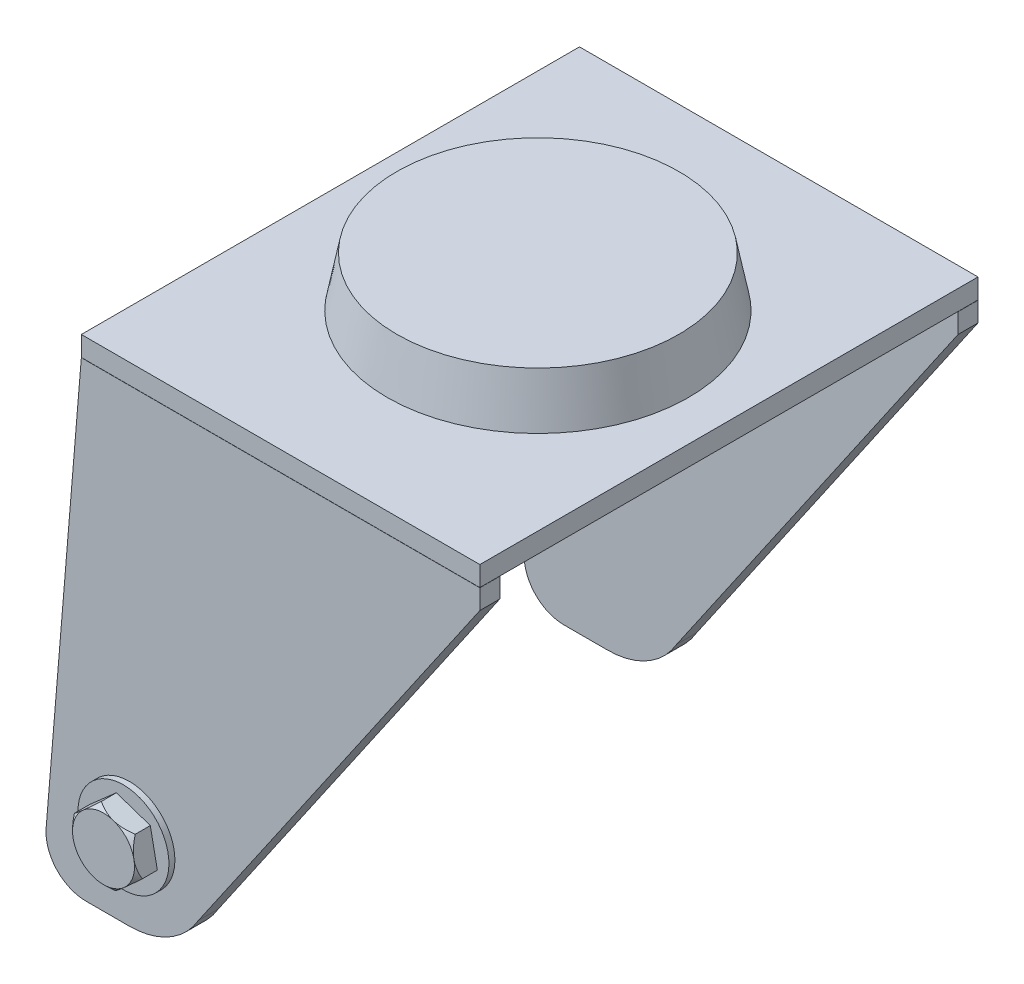
from build123d import *

# Parameters (mm, degrees)
BOSS_EXTRUDE1_DEPTH = 10
BOSS_EXTRUDE2_DEPTH = 10
SKETCH3_W           = 200
SKETCH3_H           = 250
BOSS_EXTRUDE3_DEPTH = 10
SKETCH4_R           = 75.651744531
BOSS_EXTRUDE4_DEPTH = 25
BOSS_EXTRUDE4_TAPER = 11
SKETCH5_R           = 22.82126393
BOSS_EXTRUDE5_DEPTH = 3
BOSS_EXTRUDE6_DEPTH = 10
SKETCH7_R           = 20.621564537
SKETCH7_R_2         = 15.559996937
CUT_EXTRUDE2_DEPTH  = 10
CUT_EXTRUDE2_TAPER  = 45
SKETCH9_W           = 242.267839315
SKETCH9_H           = 0.1
CUT_EXTRUDE3_DEPTH  = 408
SKETCH10_W          = 1.794871794
SKETCH10_H          = 10
SKETCH10_W_2        = 3.461538462
SKETCH10_H_2        = 1.666666666
CUT_EXTRUDE4_DEPTH  = 0.1


with BuildPart() as part:
    # Sketch1 → Boss-Extrude1 (new body)
    with BuildSketch(Plane.XY):
        with BuildLine():
            Line((-24.126688584, 195), (-41.81071568, -18.490608798))
            ThreePointArc((-41.81071568, -18.490608798), (-36.593256778, -33.687458068), (-21.878977353, -40.141610697))
            Line((-21.878977353, -40.141610697), (0, -40.141610697))
            ThreePointArc((0, -40.141610697), (19.914701785, -34.853314938), (34.582238289, -20.381798357))
            Line((34.582238289, -20.381798357), (175.873311416, 185))
            Line((175.873311416, 185), (175.873311416, 195))
            Line((175.873311416, 195), (-24.126688584, 195))
        make_face()
    extrude(amount=BOSS_EXTRUDE1_DEPTH)


with BuildPart() as body_2:
    # Sketch2 → Boss-Extrude2 (new body)
    with BuildSketch(Plane(origin=(0, 0, -230), x_dir=(-1, 0, 0), z_dir=(0, 0, -1))):
        with BuildLine():
            Line((41.81071568, -18.490608798), (24.126688584, 195))
            Line((24.126688584, 195), (-175.873311416, 195))
            Line((-175.873311416, 195), (-175.873311416, 185))
            Line((-175.873311416, 185), (-34.582238289, -20.381798357))
            ThreePointArc((-34.582238289, -20.381798357), (-19.914701785, -34.853314938), (0, -40.141610697))
            Line((0, -40.141610697), (21.878977353, -40.141610697))
            ThreePointArc((21.878977353, -40.141610697), (36.593256778, -33.687458068), (41.81071568, -18.490608798))
        make_face()
    extrude(amount=BOSS_EXTRUDE2_DEPTH)


with BuildPart() as body_3:
    # Sketch3 → Boss-Extrude3 (new body)
    with BuildSketch(Plane(origin=(0, 195, 0), x_dir=(1, 0, 0), z_dir=(0, 1, 0))):
        with Locations((75.873311416, 115)):
            Rectangle(SKETCH3_W, SKETCH3_H)
    extrude(amount=BOSS_EXTRUDE3_DEPTH)

    # Sketch4 → Boss-Extrude4 (add)
    with BuildSketch(Plane(origin=(0, 205, 0), x_dir=(1, 0, 0), z_dir=(0, 1, 0))):
        with Locations((80, 115)):
            Circle(SKETCH4_R)
    extrude(amount=BOSS_EXTRUDE4_DEPTH, taper=BOSS_EXTRUDE4_TAPER)


with BuildPart() as body_4:
    # Sketch5 → Boss-Extrude5 (new body)
    with BuildSketch(Plane(origin=(0, 0, -240), x_dir=(-1, 0, 0), z_dir=(0, 0, -1))):
        with Locations(Location((0, 0, 0), (0, 0, 90))):
            Circle(SKETCH5_R)
    extrude(amount=BOSS_EXTRUDE5_DEPTH)


with BuildPart() as body_5:
    # Sketch6 → Boss-Extrude6 (new body)
    with BuildSketch(Plane(origin=(0, 0, -243), x_dir=(-1, 0, 0), z_dir=(0, 0, -1))):
        Polygon((17.023125346, 5.747278458), (3.534273526, 17.61609823), (-13.48885182, 11.868819773), (-17.023125346, -5.747278458), (-3.534273526, -17.61609823), (13.48885182, -11.868819773), align=None)
    extrude(amount=BOSS_EXTRUDE6_DEPTH)

    # Sketch7 → Cut-Extrude2 (cut)
    with BuildSketch(Plane(origin=(0, 0, -253), x_dir=(-1, 0, 0), z_dir=(0, 0, -1))):
        Circle(SKETCH7_R)
        Circle(SKETCH7_R_2, mode=Mode.SUBTRACT)
    extrude(amount=-CUT_EXTRUDE2_DEPTH, taper=CUT_EXTRUDE2_TAPER, mode=Mode.SUBTRACT)


with BuildPart() as body_6:
    # Mirror3: mirrored copy
    add(body_4.part.mirror(Plane.XY.offset(-115)))


with BuildPart() as body_7:
    # Mirror3 2: mirrored copy
    add(body_5.part.mirror(Plane.XY.offset(-115)))


with BuildPart() as cut_extrude3_tool:
    # Sketch9 → Cut-Extrude3 (new body)
    with BuildSketch(Plane(origin=(0, 0, -240), x_dir=(-1, 0, 0), z_dir=(0, 0, -1))):
        with Locations((-54.739391758, 194.95)):
            Rectangle(SKETCH9_W, SKETCH9_H)
    extrude(amount=-CUT_EXTRUDE3_DEPTH)


with BuildPart() as part_1:
    add(part.part)

    # Cut-Extrude3: cut by cut_extrude3_tool
    add(cut_extrude3_tool.part, mode=Mode.SUBTRACT)


with BuildPart() as body_2_1:
    add(body_2.part)

    # Cut-Extrude3: cut by cut_extrude3_tool
    add(cut_extrude3_tool.part, mode=Mode.SUBTRACT)

    # Sketch10 → Cut-Extrude4 (cut)
    # profile 1 of 22: a face of its own
    with BuildSketch(Plane(origin=(0, 0, -240), x_dir=(-1, 0, 0), z_dir=(0, 0, -1))):
        with BuildLine():
            Line((-158.207066814, 175.47181736), (-158.207066814, 185.47181736))
            Line((-158.207066814, 185.47181736), (-156.604502711, 185.47181736))
            add(Edge.make_bspline(
                [(-156.604502711, 185.47181736), (-156.492313204, 185.471830164), (-156.275228633, 185.471854938), (-155.962032253, 185.46085651), (-155.67156906, 185.44662881), (-155.404763421, 185.430711323), (-155.161161215, 185.403282312), (-154.941132878, 185.374375131), (-154.744238793, 185.339514852), (-154.622509879, 185.308244102), (-154.565239891, 185.293532104)],
                knots=[0, 0, 0, 0, 1.311965854, 2.538629056, 3.664479157, 4.713267157, 5.663616078, 6.530575999, 7.308677837, 8, 8, 8, 8], degree=3))
            add(Edge.make_bspline(
                [(-154.565239891, 185.293532104), (-154.490038581, 185.272780569), (-154.342469469, 185.232059395), (-154.131103409, 185.149821225), (-153.930593217, 185.058407669), (-153.741183711, 184.954121898), (-153.56403794, 184.835704892), (-153.399829119, 184.702216857), (-153.245015669, 184.559015996), (-153.105094663, 184.402111344), (-152.978629128, 184.236312514), (-152.868753252, 184.061662949), (-152.773285199, 183.880833157), (-152.69688575, 183.691547514), (-152.6393202, 183.494677731), (-152.597216998, 183.291064474), (-152.569928421, 183.08006346), (-152.567350008, 182.936512573), (-152.566041173, 182.863644283)],
                knots=[0, 0, 0, 0, 1.099996261, 2.158545794, 3.195537121, 4.207578794, 5.205712374, 6.197378256, 7.190519799, 8.17788031, 9.159561366, 10.129234751, 11.085776129, 12.040971148, 13.00380137, 13.975669004, 14.972423361, 16, 16, 16, 16], degree=3))
            add(Edge.make_bspline(
                [(-152.566041173, 182.863644283), (-152.569463389, 182.770027658), (-152.576199601, 182.585754832), (-152.619230985, 182.315091391), (-152.699921533, 182.059275536), (-152.805503153, 181.813592677), (-152.949061147, 181.578959213), (-153.131352035, 181.355486705), (-153.349423302, 181.136294101), (-153.516696002, 181.00490292), (-153.603701429, 180.93656095)],
                knots=[0, 0, 0, 0, 0.986156485, 1.941127874, 2.875419072, 3.804401753, 4.751181392, 5.761612777, 6.835722519, 8, 8, 8, 8], degree=3))
            add(Edge.make_bspline(
                [(-153.603701429, 180.93656095), (-153.533196405, 180.900568746), (-153.394955558, 180.829997993), (-153.198694168, 180.714000741), (-153.016977545, 180.590622952), (-152.848990926, 180.462347036), (-152.698258023, 180.323735193), (-152.558554821, 180.182774425), (-152.436773551, 180.031388269), (-152.327873069, 179.874972415), (-152.23321854, 179.711261942), (-152.150784882, 179.540533322), (-152.081156129, 179.362203307), (-152.0221927, 179.177179454), (-151.978217759, 178.984825367), (-151.949545162, 178.785072251), (-151.92759163, 178.578601368), (-151.925883851, 178.437958558), (-151.925015532, 178.36644877)],
                knots=[0, 0, 0, 0, 1.164658916, 2.283573913, 3.35186032, 4.395461096, 5.390182219, 6.362969632, 7.312859996, 8.245001507, 9.165155236, 10.092416118, 11.032087915, 11.979892451, 12.947605196, 13.931445124, 14.948243989, 16, 16, 16, 16], degree=3))
            add(Edge.make_bspline(
                [(-151.925015532, 178.36644877), (-151.930650344, 178.229869164), (-151.941770624, 177.960329859), (-152.023076683, 177.564584255), (-152.164035556, 177.189381528), (-152.353314254, 176.836212895), (-152.586542029, 176.515302007), (-152.854687087, 176.234186856), (-153.155049823, 175.996229121), (-153.432170752, 175.83562611), (-153.671858531, 175.727846471), (-153.87038744, 175.661210302), (-154.083603281, 175.599478655), (-154.315411655, 175.556129419), (-154.561610192, 175.51645143), (-154.824599344, 175.491953418), (-155.103887589, 175.475351719), (-155.295714829, 175.473019298), (-155.394566814, 175.47181736)],
                knots=[0, 0, 0, 0, 1.284142165, 2.534249414, 3.780121997, 5.041676246, 6.291546858, 7.49970053, 8.684500223, 9.883330709, 10.50184324, 11.153274765, 11.851151195, 12.587658647, 13.369265475, 14.195992086, 15.070362669, 16, 16, 16, 16], degree=3))
            Line((-155.394566814, 175.47181736), (-158.207066814, 175.47181736))
        make_face()
        with BuildLine():
            Line((-156.412195019, 183.676945565), (-156.412195019, 181.497458386))
            Line((-156.412195019, 181.497458386), (-155.935432198, 181.497458386))
            add(Edge.make_bspline(
                [(-155.935432198, 181.497458386), (-155.870635848, 181.498023434), (-155.745550414, 181.499114227), (-155.564877773, 181.513163253), (-155.396881394, 181.537131764), (-155.242198452, 181.570573867), (-155.099388018, 181.613040462), (-154.969362408, 181.664136921), (-154.852693319, 181.726480155), (-154.717150822, 181.819343153), (-154.573872629, 181.955995212), (-154.447746446, 182.153417424), (-154.373458967, 182.380452218), (-154.365185345, 182.540574733), (-154.360912968, 182.623259668)],
                knots=[0, 0, 0, 0, 1.065314748, 2.056525647, 2.977365736, 3.853934255, 4.656397591, 5.425096493, 6.14721249, 6.826394842, 8.123232004, 9.372140726, 10.643011755, 12, 12, 12, 12], degree=3))
            add(Edge.make_bspline(
                [(-154.360912968, 182.623259668), (-154.364331652, 182.700707847), (-154.370941541, 182.850450789), (-154.445739481, 183.060703215), (-154.56191547, 183.247029895), (-154.699077553, 183.37455527), (-154.828242308, 183.461651342), (-154.938841097, 183.519000396), (-155.060231573, 183.570338683), (-155.194763725, 183.609593188), (-155.341669302, 183.639048387), (-155.5002347, 183.660679703), (-155.670733499, 183.675402897), (-155.788497383, 183.676420313), (-155.849294378, 183.676945565)],
                knots=[0, 0, 0, 0, 1.347982417, 2.606269829, 3.849316587, 5.153353503, 5.842674298, 6.568177932, 7.326619318, 8.142485038, 9.012069166, 9.942760135, 10.937925643, 12, 12, 12, 12], degree=3))
            Line((-155.849294378, 183.676945565), (-156.412195019, 183.676945565))
        make_face(mode=Mode.SUBTRACT)
        with BuildLine():
            Line((-156.412195019, 179.830791719), (-156.412195019, 177.266689155))
            Line((-156.412195019, 177.266689155), (-155.895368096, 177.266689155))
            add(Edge.make_bspline(
                [(-155.895368096, 177.266689155), (-155.793190755, 177.26727289), (-155.596742067, 177.268395194), (-155.31532967, 177.281955296), (-155.059455448, 177.306394991), (-154.829797371, 177.33690598), (-154.626003675, 177.378243599), (-154.44876323, 177.430799083), (-154.295645414, 177.48861927), (-154.167568329, 177.560034066), (-154.062936688, 177.643143179), (-153.968517602, 177.728082689), (-153.891534162, 177.826068438), (-153.830623429, 177.93289417), (-153.777905296, 178.045906257), (-153.746109441, 178.169517779), (-153.721901193, 178.300065189), (-153.720568949, 178.390362008), (-153.719887327, 178.43656095)],
                knots=[0, 0, 0, 0, 1.753078804, 3.370512758, 4.83203934, 6.162291463, 7.344201807, 8.395507345, 9.331626367, 10.147333109, 10.898971645, 11.62040215, 12.321813352, 13.025280112, 13.727906689, 14.453419512, 15.208716525, 16, 16, 16, 16], degree=3))
            add(Edge.make_bspline(
                [(-153.719887327, 178.43656095), (-153.721390499, 178.489390166), (-153.724318273, 178.592287267), (-153.748229445, 178.742682362), (-153.791683854, 178.883086162), (-153.846416803, 179.017088982), (-153.92258061, 179.139893053), (-154.013098691, 179.255748159), (-154.122467641, 179.360731089), (-154.245459406, 179.461191602), (-154.388917122, 179.549150224), (-154.552908097, 179.625469909), (-154.738323218, 179.689209299), (-154.945736828, 179.739958643), (-155.174239642, 179.78302891), (-155.425499481, 179.808746614), (-155.697423763, 179.827874001), (-155.885980486, 179.829797047), (-155.983509122, 179.830791719)],
                knots=[0, 0, 0, 0, 0.845221588, 1.646264278, 2.427170338, 3.19324141, 3.95557735, 4.731569926, 5.540061037, 6.376114724, 7.268642756, 8.224665384, 9.265483498, 10.400594375, 11.639216012, 12.983232105, 14.439614077, 16, 16, 16, 16], degree=3))
            Line((-155.983509122, 179.830791719), (-156.412195019, 179.830791719))
        make_face(mode=Mode.SUBTRACT)
    # profile 2 of 22: a face of its own
    with BuildSketch(Plane(origin=(0, 0, -240), x_dir=(-1, 0, 0), z_dir=(0, 0, -1))):
        Polygon((-150.130143737, 185.47181736), (-148.335271942, 185.47181736), (-148.335271942, 177.266689155), (-145.514759122, 177.266689155), (-145.514759122, 175.47181736), (-150.130143737, 175.47181736), align=None)
    # profile 3 of 22: a face of its own
    with BuildSketch(Plane(origin=(0, 0, -240), x_dir=(-1, 0, 0), z_dir=(0, 0, -1))):
        with Locations((-143.335271942, 180.47181736)):
            Rectangle(SKETCH10_W, SKETCH10_H)
    # profile 4 of 22: a face of its own
    with BuildSketch(Plane(origin=(0, 0, -240), x_dir=(-1, 0, 0), z_dir=(0, 0, -1))):
        with BuildLine():
            Line((-131.155784763, 183.737041719), (-132.471890532, 182.479028899))
            add(Edge.make_bspline(
                [(-132.471890532, 182.479028899), (-132.583533345, 182.594467755), (-132.801606736, 182.819956007), (-133.153005036, 183.118482581), (-133.518446474, 183.367264088), (-133.890822115, 183.576786289), (-134.276829918, 183.735304767), (-134.672006581, 183.850819853), (-135.078875425, 183.921245034), (-135.354228609, 183.929302921), (-135.492723865, 183.933355822)],
                knots=[0, 0, 0, 0, 1.115251505, 2.178435587, 3.19620269, 4.182487026, 5.141301733, 6.088180966, 7.038406374, 8, 8, 8, 8], degree=3))
            add(Edge.make_bspline(
                [(-135.492723865, 183.933355822), (-135.608384234, 183.930153888), (-135.83662723, 183.923835226), (-136.171747758, 183.877513197), (-136.492307863, 183.79874057), (-136.799404872, 183.6901773), (-137.09213514, 183.54970219), (-137.371112411, 183.377423964), (-137.635648879, 183.17489854), (-137.88225017, 182.943173794), (-138.107832365, 182.689997096), (-138.307148598, 182.419858162), (-138.474107915, 182.133375868), (-138.611128711, 181.833451493), (-138.717862614, 181.518696841), (-138.794084031, 181.189323816), (-138.838168461, 180.84494016), (-138.844748358, 180.610830717), (-138.848092455, 180.491849411)],
                knots=[0, 0, 0, 0, 1.035432265, 2.043311493, 3.022114605, 3.98653278, 4.95457646, 5.923598177, 6.917315552, 7.932509744, 8.948865224, 9.949768934, 10.933144597, 11.912367597, 12.897413939, 13.903909035, 14.934704909, 16, 16, 16, 16], degree=3))
            add(Edge.make_bspline(
                [(-138.848092455, 180.491849411), (-138.847128724, 180.408340006), (-138.845229191, 180.243741252), (-138.824435445, 180.000254013), (-138.790952609, 179.764013828), (-138.742494651, 179.535378537), (-138.681897498, 179.314150004), (-138.61080324, 179.098419702), (-138.521616539, 178.891168537), (-138.422617954, 178.689989421), (-138.307483742, 178.50037178), (-138.183347821, 178.319555621), (-138.048742683, 178.148427289), (-137.902796481, 177.987686361), (-137.743455204, 177.839844858), (-137.574837236, 177.70045701), (-137.394098223, 177.573012166), (-137.204992573, 177.454311959), (-137.005886653, 177.351196079), (-136.802182668, 177.257793013), (-136.590792055, 177.181935837), (-136.374288621, 177.120788032), (-136.153446073, 177.068790957), (-135.926104367, 177.03677476), (-135.69423427, 177.012529268), (-135.537529003, 177.011032251), (-135.458669378, 177.010278899)],
                knots=[0, 0, 0, 0, 1.103660481, 2.175337485, 3.227646561, 4.255952547, 5.262355991, 6.258840057, 7.255597736, 8.242457506, 9.22035537, 10.185017736, 11.140346927, 12.096287581, 13.051739095, 14.01125915, 14.986044842, 15.97314143, 16.960198552, 17.947847494, 18.933482797, 19.925264591, 20.920966487, 21.929612487, 22.958107872, 24, 24, 24, 24], degree=3))
            add(Edge.make_bspline(
                [(-135.458669378, 177.010278899), (-135.324909901, 177.014147932), (-135.062107311, 177.021749578), (-134.676406724, 177.081193369), (-134.308872489, 177.178975043), (-134.015214394, 177.294449517), (-133.785141033, 177.408482059), (-133.609989585, 177.513956545), (-133.428869336, 177.631941339), (-133.244788539, 177.766889313), (-133.05567665, 177.917181038), (-132.86487193, 178.086108184), (-132.667489745, 178.268108221), (-132.538186632, 178.398005224), (-132.471890532, 178.464605822)],
                knots=[0, 0, 0, 0, 1.404581149, 2.759636711, 4.088442092, 5.392261763, 6.066678138, 6.783632037, 7.538459478, 8.336747902, 9.180226004, 10.074962426, 11.012997595, 12, 12, 12, 12], degree=3))
            Line((-132.471890532, 178.464605822), (-131.195848865, 177.124461591))
            add(Edge.make_bspline(
                [(-131.195848865, 177.124461591), (-131.285547726, 177.037860157), (-131.460620719, 176.868832678), (-131.72471347, 176.628829431), (-131.988473849, 176.413159833), (-132.245529956, 176.213996023), (-132.500092638, 176.037140127), (-132.752134898, 175.882415517), (-132.998803508, 175.745908984), (-133.245220622, 175.629922642), (-133.492919572, 175.531438192), (-133.747772684, 175.446649545), (-134.010559067, 175.3749214), (-134.282883699, 175.317046207), (-134.562206504, 175.270638115), (-134.851141571, 175.239312921), (-135.14785691, 175.218254036), (-135.349123521, 175.216361721), (-135.450656557, 175.215407104)],
                knots=[0, 0, 0, 0, 1.244526981, 2.429050516, 3.560637417, 4.644440555, 5.67424972, 6.652764056, 7.595344123, 8.486817594, 9.369275933, 10.254498637, 11.166417451, 12.086725134, 13.032340136, 13.991389299, 14.986715468, 16, 16, 16, 16], degree=3))
            add(Edge.make_bspline(
                [(-135.450656557, 175.215407104), (-135.637160169, 175.220161453), (-136.002095894, 175.229464392), (-136.536899685, 175.298392875), (-137.04494893, 175.413950261), (-137.527479618, 175.577380279), (-137.984338316, 175.786154468), (-138.415408145, 176.04210182), (-138.819994317, 176.344542324), (-139.194828571, 176.689931083), (-139.533883994, 177.071383972), (-139.833569722, 177.480959727), (-140.081469769, 177.920671263), (-140.287306518, 178.384022635), (-140.44826815, 178.873128296), (-140.561557851, 179.38851731), (-140.631422783, 179.929692036), (-140.639066105, 180.299326849), (-140.64296425, 180.487843001)],
                knots=[0, 0, 0, 0, 1.078019885, 2.10938526, 3.111377082, 4.085535484, 5.04941344, 6.010039228, 6.978205633, 7.964457913, 8.951525778, 9.924444315, 10.892603023, 11.863865945, 12.85144698, 13.863884204, 14.910567087, 16, 16, 16, 16], degree=3))
            add(Edge.make_bspline(
                [(-140.64296425, 180.487843001), (-140.641317083, 180.610791627), (-140.638052801, 180.854445755), (-140.603744894, 181.213368025), (-140.555917677, 181.563253037), (-140.480044146, 181.900467825), (-140.388586088, 182.229555294), (-140.274845977, 182.546938648), (-140.139005471, 182.853530078), (-139.98544303, 183.149842838), (-139.811719376, 183.43393576), (-139.617650984, 183.703368039), (-139.40823393, 183.960219642), (-139.178436264, 184.201082956), (-138.931597247, 184.428072809), (-138.666602429, 184.639959098), (-138.385045622, 184.839780511), (-138.086164756, 185.022384141), (-137.775766289, 185.187558829), (-137.457765164, 185.333249959), (-137.132942672, 185.455014193), (-136.802672192, 185.556013133), (-136.465558335, 185.631401701), (-136.124007335, 185.688468415), (-135.775113003, 185.720369072), (-135.540860685, 185.725591414), (-135.422611686, 185.728227617)],
                knots=[0, 0, 0, 0, 1.071919942, 2.124283339, 3.142214191, 4.149696895, 5.136002878, 6.119640489, 7.086990633, 8.058538607, 9.028339693, 9.988281803, 10.952401235, 11.916291999, 12.888973767, 13.874849856, 14.873389453, 15.898127285, 16.927174885, 17.938320013, 18.946391617, 19.950418109, 20.947802303, 21.956882652, 22.968648068, 24, 24, 24, 24], degree=3))
            add(Edge.make_bspline(
                [(-135.422611686, 185.728227617), (-135.321733165, 185.726716479), (-135.121024979, 185.723709916), (-134.822136811, 185.698646944), (-134.52563901, 185.659285798), (-134.23259313, 185.599898212), (-133.940903007, 185.529397643), (-133.654401776, 185.437086872), (-133.368569725, 185.334189122), (-133.087889706, 185.211195873), (-132.81196993, 185.076937631), (-132.547274253, 184.924616779), (-132.289358459, 184.763606974), (-132.043937806, 184.584378949), (-131.806415038, 184.393433638), (-131.578032182, 184.189880173), (-131.360793431, 183.970324721), (-131.224466453, 183.815195834), (-131.155784763, 183.737041719)],
                knots=[0, 0, 0, 0, 0.996412454, 1.982464992, 2.961075852, 3.949442424, 4.934965278, 5.923860011, 6.921385422, 7.934793307, 8.949617135, 9.951082467, 10.950285876, 11.951772932, 12.951063433, 13.960125323, 14.972308753, 16, 16, 16, 16], degree=3))
        make_face()
    # profile 5 of 22: a face of its own
    with BuildSketch(Plane(origin=(0, 0, -240), x_dir=(-1, 0, 0), z_dir=(0, 0, -1))):
        Polygon((-129.360912968, 185.47181736), (-127.566041173, 185.47181736), (-127.566041173, 181.95218595), (-124.729502711, 185.47181736), (-122.463877711, 185.47181736), (-126.027579634, 181.048740437), (-122.117323224, 175.47181736), (-124.278781557, 175.47181736), (-127.566041173, 180.161320565), (-127.566041173, 175.47181736), (-129.360912968, 175.47181736), align=None)
    # profile 6 of 22: a face of its own
    with BuildSketch(Plane(origin=(0, 0, -240), x_dir=(-1, 0, 0), z_dir=(0, 0, -1))):
        Polygon((-120.771169378, 185.47181736), (-118.976297583, 185.47181736), (-118.976297583, 177.266689155), (-116.155784763, 177.266689155), (-116.155784763, 175.47181736), (-120.771169378, 175.47181736), align=None)
    # profile 7 of 22: a face of its own
    with BuildSketch(Plane(origin=(0, 0, -240), x_dir=(-1, 0, 0), z_dir=(0, 0, -1))):
        Polygon((-114.617323224, 185.47181736), (-109.232707839, 185.47181736), (-109.232707839, 183.676945565), (-112.822451429, 183.676945565), (-112.822451429, 181.753868642), (-109.232707839, 181.753868642), (-109.232707839, 179.958996847), (-112.822451429, 179.958996847), (-112.822451429, 177.266689155), (-109.232707839, 177.266689155), (-109.232707839, 175.47181736), (-114.617323224, 175.47181736), align=None)
    # profile 8 of 22: a face of its own
    with BuildSketch(Plane(origin=(0, 0, -240), x_dir=(-1, 0, 0), z_dir=(0, 0, -1))):
        Polygon((-103.591682198, 185.47181736), (-101.796810404, 185.47181736), (-101.796810404, 177.266689155), (-98.976297583, 177.266689155), (-98.976297583, 175.47181736), (-103.591682198, 175.47181736), align=None)
    # profile 9 of 22: a face of its own
    with BuildSketch(Plane(origin=(0, 0, -240), x_dir=(-1, 0, 0), z_dir=(0, 0, -1))):
        with BuildLine():
            Line((-92.309630916, 184.13567954), (-93.651778352, 182.907714796))
            add(Edge.make_bspline(
                [(-93.651778352, 182.907714796), (-93.709270193, 182.988813015), (-93.819646511, 183.144510286), (-93.998555009, 183.352992601), (-94.176655644, 183.530843531), (-94.355598409, 183.677320096), (-94.536969385, 183.791532343), (-94.720453738, 183.872395876), (-94.905011245, 183.923801591), (-95.029005401, 183.93020284), (-95.090079634, 183.933355822)],
                knots=[0, 0, 0, 0, 1.299362458, 2.494594718, 3.587462134, 4.587049575, 5.512617175, 6.380583204, 7.202344345, 8, 8, 8, 8], degree=3))
            add(Edge.make_bspline(
                [(-95.090079634, 183.933355822), (-95.147047927, 183.931357948), (-95.257038734, 183.927500578), (-95.413838789, 183.88915861), (-95.553048111, 183.822986003), (-95.674530837, 183.736459753), (-95.77076308, 183.632215681), (-95.847597063, 183.522890454), (-95.890861052, 183.402220127), (-95.896555444, 183.319338879), (-95.899374506, 183.278307745)],
                knots=[0, 0, 0, 0, 1.185010067, 2.2879431, 3.333075148, 4.379039566, 5.372662701, 6.27520591, 7.14612461, 8, 8, 8, 8], degree=3))
            add(Edge.make_bspline(
                [(-95.899374506, 183.278307745), (-95.897607943, 183.236684923), (-95.89405033, 183.152862345), (-95.859688633, 183.030009917), (-95.807895745, 182.909968794), (-95.758405525, 182.83689405), (-95.73310848, 182.799541719)],
                knots=[0, 0, 0, 0, 0.967525499, 1.948461899, 2.951351359, 4, 4, 4, 4], degree=3))
            add(Edge.make_bspline(
                [(-95.73310848, 182.799541719), (-95.71011073, 182.770508143), (-95.657172946, 182.703676685), (-95.556231434, 182.597826073), (-95.429470095, 182.468149808), (-95.272010885, 182.319107077), (-95.090390369, 182.145337721), (-94.876190201, 181.953672678), (-94.635575997, 181.738176305), (-94.464552995, 181.588112435), (-94.374935404, 181.509477617)],
                knots=[0, 0, 0, 0, 0.473873513, 1.090794244, 1.870441696, 2.795289791, 3.865433203, 5.087734844, 6.473946851, 8, 8, 8, 8], degree=3))
            add(Edge.make_bspline(
                [(-94.374935404, 181.509477617), (-94.290816402, 181.436676864), (-94.131176014, 181.29851616), (-93.904039443, 181.102419224), (-93.704424227, 180.925995593), (-93.529422426, 180.771893006), (-93.381686899, 180.638494576), (-93.260596563, 180.52516266), (-93.164672506, 180.434103621), (-93.110145296, 180.379103906), (-93.086874506, 180.355631463)],
                knots=[0, 0, 0, 0, 1.543621617, 2.929473131, 4.163658386, 5.240097082, 6.164993805, 6.925417477, 7.541396219, 8, 8, 8, 8], degree=3))
            add(Edge.make_bspline(
                [(-93.086874506, 180.355631463), (-92.998589979, 180.260088697), (-92.828876114, 180.076421947), (-92.608307917, 179.791796247), (-92.426773157, 179.513943528), (-92.286334423, 179.23763554), (-92.180269444, 178.958885708), (-92.105492228, 178.670857708), (-92.060707656, 178.370541828), (-92.055735523, 178.165612901), (-92.05322066, 178.061961591)],
                knots=[0, 0, 0, 0, 1.206664779, 2.319633467, 3.337109185, 4.282041471, 5.190008762, 6.099243693, 7.03861361, 8, 8, 8, 8], degree=3))
            add(Edge.make_bspline(
                [(-92.05322066, 178.061961591), (-92.055010675, 177.960966101), (-92.058522751, 177.762809191), (-92.101538944, 177.47283607), (-92.162877511, 177.195319208), (-92.257717696, 176.933278382), (-92.373308352, 176.682412269), (-92.518217934, 176.446628568), (-92.688394367, 176.223541051), (-92.88344269, 176.017137679), (-93.099189295, 175.829840926), (-93.330598034, 175.663104932), (-93.579931737, 175.525443131), (-93.845060136, 175.412088457), (-94.125841314, 175.324781171), (-94.421940777, 175.26025295), (-94.733811427, 175.221524129), (-94.947073073, 175.217475491), (-95.056025147, 175.215407104)],
                knots=[0, 0, 0, 0, 1.043214005, 2.046824704, 3.02475056, 3.976699089, 4.921714032, 5.875962561, 6.831408892, 7.817874052, 8.806269674, 9.781291748, 10.760897367, 11.74438705, 12.757449933, 13.795994037, 14.874007457, 16, 16, 16, 16], degree=3))
            add(Edge.make_bspline(
                [(-95.056025147, 175.215407104), (-95.141551598, 175.2169244), (-95.31094302, 175.219929517), (-95.560600367, 175.244463793), (-95.801672758, 175.284059505), (-96.033888646, 175.340811987), (-96.258294205, 175.412725081), (-96.47489865, 175.500564169), (-96.68220669, 175.605690726), (-96.881786916, 175.725942931), (-97.07266912, 175.865571581), (-97.257266934, 176.021722014), (-97.433746757, 176.196795894), (-97.602956186, 176.390379177), (-97.763812571, 176.603020045), (-97.921581319, 176.831757081), (-98.069250712, 177.080835333), (-98.160472665, 177.255565741), (-98.207066814, 177.344814155)],
                knots=[0, 0, 0, 0, 1.016823716, 2.013894106, 2.979844003, 3.91962641, 4.853723003, 5.779685073, 6.695824784, 7.614987388, 8.547259901, 9.504950863, 10.487499108, 11.500346958, 12.559593716, 13.656357062, 14.802919212, 16, 16, 16, 16], degree=3))
            Line((-98.207066814, 177.344814155), (-96.628541173, 178.292330181))
            add(Edge.make_bspline(
                [(-96.628541173, 178.292330181), (-96.570258857, 178.19102157), (-96.458526676, 177.996804304), (-96.269186049, 177.735848793), (-96.075216244, 177.512383593), (-95.872132851, 177.330358467), (-95.662405288, 177.187339505), (-95.445020524, 177.085128233), (-95.219825827, 177.021859571), (-95.06643343, 177.014133006), (-94.989919378, 177.010278899)],
                knots=[0, 0, 0, 0, 1.283663364, 2.460892379, 3.537111102, 4.529833553, 5.449777664, 6.316464042, 7.160231139, 8, 8, 8, 8], degree=3))
            add(Edge.make_bspline(
                [(-94.989919378, 177.010278899), (-94.912093632, 177.013426372), (-94.761100351, 177.019532928), (-94.545576764, 177.075937349), (-94.34797658, 177.164496426), (-94.177172439, 177.290858018), (-94.032546262, 177.436698501), (-93.925803842, 177.598952707), (-93.858747533, 177.77450784), (-93.851658056, 177.896459984), (-93.848092455, 177.957794924)],
                knots=[0, 0, 0, 0, 1.13588714, 2.203786484, 3.234766741, 4.283437687, 5.291419208, 6.222934724, 7.106237994, 8, 8, 8, 8], degree=3))
            add(Edge.make_bspline(
                [(-93.848092455, 177.957794924), (-93.851385141, 178.014857105), (-93.858073919, 178.130773463), (-93.907341393, 178.303122447), (-93.984361482, 178.47539305), (-94.075481678, 178.61669406), (-94.168207888, 178.735001565), (-94.256875058, 178.837509667), (-94.364848217, 178.950763173), (-94.491853592, 179.074904548), (-94.636213109, 179.211026641), (-94.798048374, 179.35911612), (-94.979212572, 179.517868496), (-95.107259784, 179.626009047), (-95.17421425, 179.68255454)],
                knots=[0, 0, 0, 0, 0.916159276, 1.861089862, 2.860218735, 3.940849679, 4.552606315, 5.27541173, 6.11797699, 7.06649574, 8.129236253, 9.306560635, 10.591630461, 12, 12, 12, 12], degree=3))
            add(Edge.make_bspline(
                [(-95.17421425, 179.68255454), (-95.301497354, 179.790248251), (-95.545792156, 179.99694508), (-95.891011706, 180.302229789), (-96.202085431, 180.587546323), (-96.476326564, 180.856421817), (-96.717229362, 181.103890764), (-96.923162326, 181.331963203), (-97.091863189, 181.542398399), (-97.269384471, 181.791644807), (-97.438065182, 182.09536868), (-97.583853183, 182.46078371), (-97.678434286, 182.826152374), (-97.689030783, 183.071440771), (-97.694246301, 183.192169924)],
                knots=[0, 0, 0, 0, 1.345494975, 2.582412109, 3.71882943, 4.751509156, 5.681369928, 6.505683931, 7.230279997, 7.856715994, 8.973648664, 10.023341002, 11.027102913, 12, 12, 12, 12], degree=3))
            add(Edge.make_bspline(
                [(-97.694246301, 183.192169924), (-97.692077174, 183.27778456), (-97.687803761, 183.446454588), (-97.649684254, 183.694459289), (-97.592713199, 183.933762987), (-97.509974871, 184.163492593), (-97.402590512, 184.383360362), (-97.272176379, 184.594442639), (-97.116707388, 184.794796671), (-96.94150433, 184.984289637), (-96.748475418, 185.157464643), (-96.542199495, 185.310308938), (-96.323844101, 185.439403452), (-96.094745023, 185.546496726), (-95.853482631, 185.628469824), (-95.601834292, 185.686576441), (-95.339439065, 185.721136404), (-95.160963495, 185.72583443), (-95.070047583, 185.728227617)],
                knots=[0, 0, 0, 0, 1.010766082, 1.991317756, 2.957454644, 3.913069143, 4.869106762, 5.843196583, 6.838735724, 7.860187025, 8.887984031, 9.89767229, 10.887916223, 11.879572884, 12.879850636, 13.892031539, 14.926195476, 16, 16, 16, 16], degree=3))
            add(Edge.make_bspline(
                [(-95.070047583, 185.728227617), (-94.952225061, 185.723917418), (-94.717510067, 185.715331043), (-94.37047718, 185.6481884), (-94.031509964, 185.542599521), (-93.758363829, 185.415218156), (-93.541026548, 185.291823767), (-93.374457824, 185.178217757), (-93.204965182, 185.048075967), (-93.031181768, 184.900988285), (-92.856336748, 184.734183387), (-92.675458441, 184.551632195), (-92.491011535, 184.351757038), (-92.371150291, 184.208967153), (-92.309630916, 184.13567954)],
                knots=[0, 0, 0, 0, 1.282922637, 2.555718331, 3.837320111, 5.142675274, 5.830281639, 6.55870424, 7.337177975, 8.157850921, 9.037902056, 9.96903443, 10.957596896, 12, 12, 12, 12], degree=3))
        make_face()
    # profile 10 of 22: a face of its own
    with BuildSketch(Plane(origin=(0, 0, -240), x_dir=(-1, 0, 0), z_dir=(0, 0, -1))):
        with BuildLine():
            Line((-90.258348865, 185.47181736), (-87.996730275, 185.47181736))
            add(Edge.make_bspline(
                [(-87.996730275, 185.47181736), (-87.820411093, 185.470584829), (-87.47958412, 185.468202332), (-86.985793264, 185.441357318), (-86.526630603, 185.400071593), (-86.101800153, 185.343275595), (-85.712172885, 185.268118938), (-85.358251215, 185.173849641), (-85.038847297, 185.065031422), (-84.750458934, 184.936984704), (-84.487188096, 184.787694949), (-84.237204033, 184.621398147), (-84.000997584, 184.43200236), (-83.775253963, 184.223161412), (-83.56288644, 183.99105462), (-83.360358335, 183.739526514), (-83.172628456, 183.46492959), (-82.994022133, 183.173847815), (-82.83249648, 182.865047614), (-82.69160777, 182.541157429), (-82.573584444, 182.204261614), (-82.477684379, 181.854001126), (-82.40124096, 181.491538723), (-82.34775504, 181.116142989), (-82.314689512, 180.72816148), (-82.31133529, 180.465207361), (-82.309630916, 180.331593001)],
                knots=[0, 0, 0, 0, 1.44355588, 2.790409838, 4.047694926, 5.217575253, 6.298404546, 7.294384826, 8.214239204, 9.058592145, 9.873746385, 10.689560431, 11.514393297, 12.350027578, 13.205127629, 14.088021785, 14.991911688, 15.926770944, 16.882954281, 17.842803888, 18.816321264, 19.80318086, 20.814351908, 21.847355356, 22.906180909, 24, 24, 24, 24], degree=3))
            add(Edge.make_bspline(
                [(-82.309630916, 180.331593001), (-82.314093887, 180.143054443), (-82.322879507, 179.771905254), (-82.39688466, 179.227248095), (-82.516576051, 178.705139886), (-82.684873017, 178.209664758), (-82.893516203, 177.74523499), (-83.142763852, 177.320040608), (-83.428961414, 176.936363839), (-83.74877467, 176.596115078), (-84.095054535, 176.303666657), (-84.454909143, 176.053205986), (-84.831844133, 175.855696848), (-85.163976538, 175.730446518), (-85.451976768, 175.65255165), (-85.704837855, 175.606515032), (-85.992062249, 175.564296677), (-86.316328068, 175.531671241), (-86.67621283, 175.502577369), (-87.073151038, 175.486768892), (-87.505857521, 175.473634394), (-87.806413086, 175.472438908), (-87.962675788, 175.47181736)],
                knots=[0, 0, 0, 0, 1.315458931, 2.589557908, 3.828601765, 5.048913369, 6.235739168, 7.376350998, 8.481830359, 9.569842114, 10.627874879, 11.640079404, 12.624025415, 13.590060155, 14.111227486, 14.704434459, 15.382649715, 16.137166398, 16.978595427, 17.902333227, 18.909396075, 20, 20, 20, 20], degree=3))
            Line((-87.962675788, 175.47181736), (-90.258348865, 175.47181736))
            Line((-90.258348865, 175.47181736), (-90.258348865, 185.47181736))
        make_face()
        with BuildLine():
            Line((-88.46347707, 183.676945565), (-88.46347707, 177.266689155))
            Line((-88.46347707, 177.266689155), (-87.52597707, 177.266689155))
            add(Edge.make_bspline(
                [(-87.52597707, 177.266689155), (-87.414428968, 177.266893557), (-87.199884833, 177.267286691), (-86.890131666, 177.286011987), (-86.603688527, 177.304807021), (-86.341343927, 177.340480624), (-86.101188603, 177.380218508), (-85.886521661, 177.435519214), (-85.692917881, 177.49360792), (-85.522742098, 177.567562044), (-85.366874946, 177.650802332), (-85.222559767, 177.748327979), (-85.083255214, 177.856626533), (-84.951565699, 177.978883207), (-84.826992807, 178.113479093), (-84.710273592, 178.261107705), (-84.599850159, 178.421318623), (-84.498556871, 178.594958921), (-84.405994522, 178.78019492), (-84.323881346, 178.975232338), (-84.255797406, 179.181695418), (-84.199210204, 179.397651416), (-84.158772232, 179.624980474), (-84.125317522, 179.861998797), (-84.108070645, 180.109645433), (-84.105703619, 180.278152481), (-84.104502711, 180.363644283)],
                knots=[0, 0, 0, 0, 1.50275155, 2.890291501, 4.180787663, 5.369391935, 6.45668281, 7.458360028, 8.354766181, 9.177074746, 9.954075863, 10.732690366, 11.5210699, 12.329727389, 13.151100085, 13.990027547, 14.863562427, 15.770965086, 16.696477834, 17.652329173, 18.619756807, 19.62365428, 20.657822005, 21.729286259, 22.847956731, 24, 24, 24, 24], degree=3))
            add(Edge.make_bspline(
                [(-84.104502711, 180.363644283), (-84.106894511, 180.494652388), (-84.111558335, 180.750108042), (-84.156535247, 181.122184778), (-84.229749079, 181.472550764), (-84.334218164, 181.799905699), (-84.465904683, 182.105169622), (-84.630741059, 182.3857563), (-84.821633369, 182.646379203), (-84.9725858, 182.799268961), (-85.048012327, 182.875663514)],
                knots=[0, 0, 0, 0, 1.13821349, 2.219428113, 3.251817212, 4.244760574, 5.201143372, 6.134805572, 7.068016741, 8, 8, 8, 8], degree=3))
            add(Edge.make_bspline(
                [(-85.048012327, 182.875663514), (-85.122390024, 182.940762001), (-85.27429805, 183.073718289), (-85.540998623, 183.233033923), (-85.834888842, 183.373008323), (-86.162692033, 183.483992413), (-86.521240126, 183.571763362), (-86.912668638, 183.632296839), (-87.334881386, 183.67119501), (-87.627380541, 183.674987647), (-87.778380916, 183.676945565)],
                knots=[0, 0, 0, 0, 0.813307809, 1.661089106, 2.549956539, 3.493439533, 4.508053171, 5.589449661, 6.755572447, 8, 8, 8, 8], degree=3))
            Line((-87.778380916, 183.676945565), (-88.46347707, 183.676945565))
        make_face(mode=Mode.SUBTRACT)
    # profile 11 of 22: a face of its own
    with BuildSketch(Plane(origin=(0, 0, -240), x_dir=(-1, 0, 0), z_dir=(0, 0, -1))):
        with Locations((-78.783989891, 179.125663514)):
            Rectangle(SKETCH10_W_2, SKETCH10_H_2)
    # profile 12 of 22: a face of its own
    with BuildSketch(Plane(origin=(0, 0, -240), x_dir=(-1, 0, 0), z_dir=(0, 0, -1))):
        with BuildLine():
            Line((-65.580864891, 183.881272488), (-66.939037968, 182.58119236))
            add(Edge.make_bspline(
                [(-66.939037968, 182.58119236), (-67.0465669, 182.688850131), (-67.257556418, 182.900092452), (-67.602603381, 183.175038849), (-67.959967315, 183.408797641), (-68.33082445, 183.601010471), (-68.71569139, 183.750107454), (-69.11380863, 183.856761296), (-69.525823854, 183.920019497), (-69.80473977, 183.92887543), (-69.945848865, 183.933355822)],
                knots=[0, 0, 0, 0, 1.075575784, 2.110457258, 3.113929901, 4.09197124, 5.059417775, 6.02750972, 7.002078037, 8, 8, 8, 8], degree=3))
            add(Edge.make_bspline(
                [(-69.945848865, 183.933355822), (-70.068186136, 183.930216431), (-70.308406092, 183.924051963), (-70.661386181, 183.877239413), (-70.998680278, 183.799041153), (-71.3218819, 183.69071052), (-71.629017789, 183.549738128), (-71.921867547, 183.378299721), (-72.198628975, 183.17508378), (-72.457122775, 182.943942573), (-72.692482211, 182.691583043), (-72.897963427, 182.421469109), (-73.072989279, 182.138635468), (-73.217071251, 181.841635099), (-73.326701963, 181.53092384), (-73.404963946, 181.206727251), (-73.454640844, 180.869987493), (-73.460506202, 180.640260142), (-73.46347707, 180.523900693)],
                knots=[0, 0, 0, 0, 1.075001177, 2.110859044, 3.123021556, 4.114053297, 5.101481495, 6.087880186, 7.091499647, 8.114004866, 9.131394192, 10.11971144, 11.092043119, 12.050101265, 13.015322563, 13.981809771, 14.977764287, 16, 16, 16, 16], degree=3))
            add(Edge.make_bspline(
                [(-73.46347707, 180.523900693), (-73.460705986, 180.403513888), (-73.455246571, 180.166335401), (-73.402802716, 179.818265776), (-73.32200393, 179.483397714), (-73.203736049, 179.164215859), (-73.058184106, 178.856347866), (-72.873600261, 178.56575743), (-72.658357026, 178.288006918), (-72.412839012, 178.027932124), (-72.145778815, 177.788205754), (-71.856543933, 177.581411617), (-71.553934665, 177.402992915), (-71.233066881, 177.26169107), (-70.899509898, 177.148241168), (-70.54988049, 177.068249251), (-70.184965938, 177.019174488), (-69.935988029, 177.013273612), (-69.809630916, 177.010278899)],
                knots=[0, 0, 0, 0, 1.022067601, 2.013613092, 2.983553406, 3.943623673, 4.90013463, 5.87121881, 6.861774014, 7.881098904, 8.905697761, 9.905387765, 10.89678721, 11.884561068, 12.87834324, 13.885584958, 14.926927371, 16, 16, 16, 16], degree=3))
            add(Edge.make_bspline(
                [(-69.809630916, 177.010278899), (-69.727440294, 177.01102049), (-69.566081814, 177.0124764), (-69.329396422, 177.036109908), (-69.102708665, 177.069896755), (-68.885140645, 177.114626529), (-68.678889216, 177.177927185), (-68.481098684, 177.251949507), (-68.292927928, 177.339310607), (-68.115397191, 177.443024604), (-67.945864299, 177.559275319), (-67.785916114, 177.692290856), (-67.632746956, 177.839072207), (-67.488146588, 178.001412512), (-67.354562413, 178.180763286), (-67.227714732, 178.373828719), (-67.109055929, 178.582524869), (-67.038943574, 178.729895519), (-67.003140532, 178.805150693)],
                knots=[0, 0, 0, 0, 1.109579412, 2.178351274, 3.208885622, 4.204702371, 5.174744997, 6.119429583, 7.05542196, 7.97267548, 8.893247984, 9.828544973, 10.778894627, 11.756245826, 12.760884819, 13.796418446, 14.874735809, 16, 16, 16, 16], degree=3))
            Line((-67.003140532, 178.805150693), (-69.87373348, 178.805150693))
            Line((-69.87373348, 178.805150693), (-69.87373348, 180.600022488))
            Line((-69.87373348, 180.600022488), (-64.887755916, 180.600022488))
            Line((-64.887755916, 180.600022488), (-64.87373348, 180.173339796))
            add(Edge.make_bspline(
                [(-64.87373348, 180.173339796), (-64.875535259, 180.063756854), (-64.879135601, 179.844786532), (-64.91203895, 179.518777024), (-64.966542846, 179.197091357), (-65.041054889, 178.880052622), (-65.134437328, 178.566105632), (-65.253529169, 178.258256691), (-65.392984987, 177.954418068), (-65.549235338, 177.655880843), (-65.724815775, 177.369426259), (-65.913853898, 177.098191583), (-66.113654837, 176.842646262), (-66.328564181, 176.606350683), (-66.555235439, 176.38731986), (-66.794114814, 176.18639643), (-67.046047211, 176.003410387), (-67.309698044, 175.836815917), (-67.586569058, 175.690805693), (-67.875138017, 175.563796169), (-68.17496922, 175.455929662), (-68.486836763, 175.367502591), (-68.810126966, 175.299274071), (-69.144846757, 175.252489685), (-69.491179967, 175.220699169), (-69.726090457, 175.217192452), (-69.845688609, 175.215407104)],
                knots=[0, 0, 0, 0, 1.006889344, 2.011981806, 3.007738725, 4.003571281, 5.003404394, 6.015442001, 7.03424805, 8.074616296, 9.110249922, 10.119753985, 11.111721717, 12.089233633, 13.052717867, 14.006597561, 14.955430184, 15.912305663, 16.870361111, 17.829300583, 18.807640451, 19.796414044, 20.806216501, 21.841577364, 22.90109906, 24, 24, 24, 24], degree=3))
            add(Edge.make_bspline(
                [(-69.845688609, 175.215407104), (-69.973291728, 175.217170168), (-70.22623917, 175.220665087), (-70.600255864, 175.253397384), (-70.963422101, 175.307419926), (-71.315828464, 175.382185279), (-71.658293168, 175.475236733), (-71.990227806, 175.592038319), (-72.310953483, 175.730977499), (-72.621430621, 175.888375111), (-72.917690985, 176.066877712), (-73.199070607, 176.26335524), (-73.464033664, 176.479071543), (-73.715294199, 176.710415485), (-73.946981795, 176.963073522), (-74.167730543, 177.228855781), (-74.366845922, 177.517510094), (-74.552889302, 177.819678206), (-74.718171727, 178.13523349), (-74.862713584, 178.458339589), (-74.985978798, 178.787125718), (-75.083176398, 179.123122815), (-75.162091747, 179.463988026), (-75.21855716, 179.811203696), (-75.250445817, 180.164726361), (-75.255702821, 180.402311904), (-75.258348865, 180.521897488)],
                knots=[0, 0, 0, 0, 1.084149091, 2.14910686, 3.187506334, 4.202448172, 5.208724393, 6.201130722, 7.189831603, 8.176984443, 9.156919086, 10.126598231, 11.090766514, 12.05840148, 13.026036446, 14.001772938, 14.991905635, 16.003017641, 17.015720547, 18.016462227, 19.009322657, 19.99686681, 20.986544154, 21.980959929, 22.983742515, 24, 24, 24, 24], degree=3))
            add(Edge.make_bspline(
                [(-75.258348865, 180.521897488), (-75.254805247, 180.68503778), (-75.247807651, 181.007191489), (-75.182999293, 181.481725946), (-75.081972719, 181.940790684), (-74.936989414, 182.382713821), (-74.750941597, 182.808104111), (-74.526464803, 183.217960178), (-74.25868291, 183.611846381), (-74.051401333, 183.855716645), (-73.946249506, 183.97942954)],
                knots=[0, 0, 0, 0, 1.034044851, 2.041932006, 3.031217818, 4.011390712, 4.986069675, 5.97149666, 6.970960976, 8, 8, 8, 8], degree=3))
            add(Edge.make_bspline(
                [(-73.946249506, 183.97942954), (-73.880961764, 184.051001199), (-73.751366579, 184.193069865), (-73.54420891, 184.390477168), (-73.331797665, 184.576047337), (-73.111190914, 184.745845471), (-72.883548346, 184.903588534), (-72.648214765, 185.046319506), (-72.406424677, 185.178583017), (-72.156292412, 185.293625191), (-71.899127447, 185.396770097), (-71.633790838, 185.48404519), (-71.362269904, 185.561350179), (-71.082160315, 185.620159448), (-70.796291849, 185.669131319), (-70.502635314, 185.701954832), (-70.201990943, 185.72601213), (-69.998650211, 185.72748328), (-69.895768737, 185.728227617)],
                knots=[0, 0, 0, 0, 1.020590567, 2.025856924, 3.013483481, 3.991664875, 4.957826714, 5.930500614, 6.890802512, 7.860442893, 8.829981142, 9.809047939, 10.802672283, 11.803273349, 12.823572789, 13.857849586, 14.916166035, 16, 16, 16, 16], degree=3))
            add(Edge.make_bspline(
                [(-69.895768737, 185.728227617), (-69.788224195, 185.726569095), (-69.574250045, 185.723269245), (-69.256105919, 185.700436441), (-68.942382619, 185.665210805), (-68.634402206, 185.61237034), (-68.331131095, 185.547207049), (-68.034139091, 185.463716744), (-67.741488689, 185.36885672), (-67.550974385, 185.2932273), (-67.455864891, 185.255471206)],
                knots=[0, 0, 0, 0, 1.03180557, 2.052914215, 3.058998889, 4.059601663, 5.049854447, 6.033765722, 7.018406786, 8, 8, 8, 8], degree=3))
            add(Edge.make_bspline(
                [(-67.455864891, 185.255471206), (-67.375842016, 185.22057778), (-67.213077704, 185.149605515), (-66.97627569, 185.019758429), (-66.738895104, 184.875808032), (-66.503497403, 184.712491162), (-66.270441267, 184.530113298), (-66.037293342, 184.331555067), (-65.806433686, 184.114501167), (-65.657028248, 183.960022207), (-65.580864891, 183.881272488)],
                knots=[0, 0, 0, 0, 0.894392155, 1.819168899, 2.76525314, 3.739198753, 4.75366411, 5.797420238, 6.877176959, 8, 8, 8, 8], degree=3))
        make_face()
    # profile 13 of 22: a face of its own
    with BuildSketch(Plane(origin=(0, 0, -240), x_dir=(-1, 0, 0), z_dir=(0, 0, -1))):
        Polygon((-64.104502711, 185.47181736), (-58.719887327, 185.47181736), (-58.719887327, 183.676945565), (-60.514759122, 183.676945565), (-60.514759122, 175.47181736), (-62.309630916, 175.47181736), (-62.309630916, 183.676945565), (-64.104502711, 183.676945565), align=None)
    # profile 14 of 22: a face of its own
    with BuildSketch(Plane(origin=(0, 0, -240), x_dir=(-1, 0, 0), z_dir=(0, 0, -1))):
        Polygon((-57.309630916, 185.47181736), (-55.514759122, 185.47181736), (-55.514759122, 181.625663514), (-52.05322066, 181.625663514), (-52.05322066, 185.47181736), (-50.258348865, 185.47181736), (-50.258348865, 175.47181736), (-52.05322066, 175.47181736), (-52.05322066, 179.830791719), (-55.514759122, 179.830791719), (-55.514759122, 175.47181736), (-57.309630916, 175.47181736), align=None)
    # profile 15 of 22: a face of its own
    with BuildSketch(Plane(origin=(0, 0, -240), x_dir=(-1, 0, 0), z_dir=(0, 0, -1))):
        with BuildLine():
            Line((-42.566041173, 183.035919924), (-44.360912968, 183.035919924))
            add(Edge.make_bspline(
                [(-44.360912968, 183.035919924), (-44.34824049, 183.125639162), (-44.323396938, 183.301527785), (-44.263949639, 183.556170694), (-44.192844254, 183.797716921), (-44.104072814, 184.025401538), (-43.999958357, 184.239630126), (-43.881559611, 184.441137813), (-43.74759664, 184.629059691), (-43.644912604, 184.742264576), (-43.593685404, 184.798740437)],
                knots=[0, 0, 0, 0, 1.111473889, 2.178970933, 3.205615836, 4.199322666, 5.174200091, 6.12565194, 7.064921805, 8, 8, 8, 8], degree=3))
            add(Edge.make_bspline(
                [(-43.593685404, 184.798740437), (-43.519796955, 184.873256243), (-43.374170589, 185.020119065), (-43.130811852, 185.208234117), (-42.875726952, 185.371034902), (-42.603800051, 185.500104542), (-42.319262536, 185.604571463), (-42.019851665, 185.67474213), (-41.706790941, 185.721300986), (-41.49316638, 185.725887196), (-41.384150147, 185.728227617)],
                knots=[0, 0, 0, 0, 1.01925491, 2.00884431, 2.983262333, 3.955970413, 4.92937149, 5.924503185, 6.940838805, 8, 8, 8, 8], degree=3))
            add(Edge.make_bspline(
                [(-41.384150147, 185.728227617), (-41.287229106, 185.725939501), (-41.096701871, 185.721441526), (-40.816674775, 185.685334226), (-40.549692373, 185.622006043), (-40.292932584, 185.539205864), (-40.050171507, 185.426542383), (-39.816051171, 185.295764061), (-39.597112905, 185.135359015), (-39.392844435, 184.954117455), (-39.205184887, 184.758086965), (-39.042670896, 184.548546493), (-38.902954702, 184.331093348), (-38.787847038, 184.103920905), (-38.699344887, 183.866644761), (-38.63792177, 183.620635628), (-38.597718848, 183.366436344), (-38.593713586, 183.193660515), (-38.591682198, 183.106032104)],
                knots=[0, 0, 0, 0, 1.091422571, 2.145516843, 3.172569842, 4.178562979, 5.178154469, 6.181868002, 7.194278174, 8.227918432, 9.254613415, 10.245994977, 11.209837596, 12.161663635, 13.10878368, 14.055455738, 15.013766427, 16, 16, 16, 16], degree=3))
            add(Edge.make_bspline(
                [(-38.591682198, 183.106032104), (-38.595850727, 182.997511614), (-38.604057279, 182.783868133), (-38.671397981, 182.471185027), (-38.77680449, 182.172204176), (-38.929074444, 181.891108774), (-39.11945067, 181.628663803), (-39.353035923, 181.393643587), (-39.623177088, 181.182363328), (-39.82597566, 181.06882129), (-39.929823224, 181.01067954)],
                knots=[0, 0, 0, 0, 0.992805628, 1.954529043, 2.915727527, 3.886831945, 4.871318353, 5.87440735, 6.911542536, 8, 8, 8, 8], degree=3))
            add(Edge.make_bspline(
                [(-39.929823224, 181.01067954), (-39.858543849, 180.98727702), (-39.718483074, 180.941292119), (-39.519403524, 180.850725376), (-39.33010162, 180.751750938), (-39.153837072, 180.636768731), (-38.988856718, 180.510428127), (-38.836166297, 180.37164912), (-38.694853519, 180.220734313), (-38.567225258, 180.056853733), (-38.453950189, 179.882628329), (-38.352314502, 179.702082605), (-38.268662666, 179.512478553), (-38.197799146, 179.31598158), (-38.143847697, 179.110825674), (-38.105861056, 178.897805796), (-38.083903845, 178.67740786), (-38.080554996, 178.528088392), (-38.078861686, 178.452586591)],
                knots=[0, 0, 0, 0, 1.059543567, 2.081955587, 3.086750234, 4.076226789, 5.052108497, 6.020845489, 6.989030705, 7.970690546, 8.952259656, 9.923888338, 10.895517021, 11.877585046, 12.873342345, 13.889638361, 14.932918083, 16, 16, 16, 16], degree=3))
            add(Edge.make_bspline(
                [(-38.078861686, 178.452586591), (-38.082294252, 178.341629598), (-38.089062575, 178.122845006), (-38.132092403, 177.800597692), (-38.212206189, 177.493363508), (-38.317600313, 177.197607262), (-38.458184635, 176.917147059), (-38.623628747, 176.645546719), (-38.826992803, 176.392225268), (-39.052997032, 176.150485544), (-39.303987904, 175.93070661), (-39.576102841, 175.740168165), (-39.863358269, 175.576652278), (-40.167571573, 175.443905422), (-40.488637061, 175.341675161), (-40.825839106, 175.267778416), (-41.180594539, 175.222567164), (-41.422742879, 175.217827622), (-41.546409763, 175.215407104)],
                knots=[0, 0, 0, 0, 1.005138573, 1.981928558, 2.936866704, 3.876260664, 4.820238198, 5.773547, 6.751179199, 7.756627054, 8.768222608, 9.766606018, 10.760583154, 11.757261445, 12.767156078, 13.807575856, 14.880313354, 16, 16, 16, 16], degree=3))
            add(Edge.make_bspline(
                [(-41.546409763, 175.215407104), (-41.66339664, 175.217959131), (-41.892148998, 175.222949282), (-42.226747198, 175.266141571), (-42.544751115, 175.335814239), (-42.8469723, 175.434023641), (-43.132241484, 175.561384452), (-43.403145599, 175.713042602), (-43.654278813, 175.897745378), (-43.888439244, 176.10715495), (-44.100432508, 176.3421006), (-44.289904562, 176.597139928), (-44.452677516, 176.873242744), (-44.589418902, 177.169229422), (-44.699059712, 177.485619212), (-44.785544061, 177.821768719), (-44.845954795, 178.178334675), (-44.86435301, 178.423659638), (-44.87373348, 178.548740437)],
                knots=[0, 0, 0, 0, 1.066544725, 2.085487077, 3.070979577, 4.031932826, 4.977951092, 5.916076795, 6.857635327, 7.814973522, 8.776389752, 9.738577119, 10.707772778, 11.69409279, 12.707140348, 13.757286496, 14.856535458, 16, 16, 16, 16], degree=3))
            Line((-44.87373348, 178.548740437), (-43.078861686, 178.548740437))
            add(Edge.make_bspline(
                [(-43.078861686, 178.548740437), (-43.06748777, 178.485848169), (-43.045334087, 178.363348985), (-43.002124687, 178.185997398), (-42.945816811, 178.022290929), (-42.880710896, 177.87077456), (-42.810386706, 177.729458933), (-42.725418268, 177.603563184), (-42.632031623, 177.489668727), (-42.497274012, 177.354269742), (-42.304628727, 177.215152937), (-42.044493769, 177.094253815), (-41.755118263, 177.023392076), (-41.552815924, 177.014747161), (-41.448252711, 177.010278899)],
                knots=[0, 0, 0, 0, 0.928156231, 1.807827665, 2.648129825, 3.438902246, 4.202261636, 4.936546065, 5.639352463, 6.338805438, 7.70633318, 9.064371875, 10.482673459, 12, 12, 12, 12], degree=3))
            add(Edge.make_bspline(
                [(-41.448252711, 177.010278899), (-41.392767775, 177.011230373), (-41.284085197, 177.013094099), (-41.124446673, 177.033751002), (-40.972368502, 177.067772938), (-40.82756743, 177.114007488), (-40.689121645, 177.171965387), (-40.559676291, 177.24669863), (-40.436592949, 177.333586693), (-40.321209648, 177.431271942), (-40.214593099, 177.537713896), (-40.125881861, 177.655580275), (-40.044806208, 177.775353583), (-39.984842071, 177.904869811), (-39.932300568, 178.037159603), (-39.900142485, 178.177024664), (-39.875860823, 178.321531), (-39.87444967, 178.420424793), (-39.87373348, 178.470615437)],
                knots=[0, 0, 0, 0, 1.110435564, 2.175094844, 3.216326037, 4.226890168, 5.215276772, 6.21526065, 7.213097102, 8.228249917, 9.239874822, 10.221364777, 11.178138315, 12.128914389, 13.072518965, 14.022636769, 14.996447288, 16, 16, 16, 16], degree=3))
            add(Edge.make_bspline(
                [(-39.87373348, 178.470615437), (-39.875634829, 178.525507457), (-39.879419978, 178.634784892), (-39.910345039, 178.794252331), (-39.959182248, 178.947647154), (-40.027023095, 179.094290058), (-40.117616987, 179.233640546), (-40.224516768, 179.368494411), (-40.356144375, 179.491832749), (-40.500557487, 179.613748958), (-40.668019964, 179.720023123), (-40.850376149, 179.818098562), (-41.052418645, 179.896136333), (-41.269215415, 179.965838517), (-41.504867371, 180.01674791), (-41.757911203, 180.053713091), (-42.027938714, 180.081227939), (-42.214072187, 180.085175397), (-42.309630916, 180.087201976)],
                knots=[0, 0, 0, 0, 0.809814727, 1.612155564, 2.388397, 3.182215007, 3.988903953, 4.837162975, 5.715530372, 6.646997145, 7.623086902, 8.637258368, 9.698941581, 10.815059213, 11.996518529, 13.252603015, 14.589518788, 16, 16, 16, 16], degree=3))
            Line((-42.309630916, 180.087201976), (-42.309630916, 181.753868642))
            add(Edge.make_bspline(
                [(-42.309630916, 181.753868642), (-42.190654615, 181.764001045), (-41.968073516, 181.782956763), (-41.659119016, 181.82728537), (-41.399019153, 181.886537851), (-41.181522423, 181.958022763), (-41.000927074, 182.049828013), (-40.843159975, 182.151176956), (-40.707283485, 182.268878941), (-40.592449625, 182.399424111), (-40.50058611, 182.539617382), (-40.435570465, 182.687279736), (-40.39263753, 182.837842316), (-40.388569638, 182.940822583), (-40.386553993, 182.991849411)],
                knots=[0, 0, 0, 0, 1.70044513, 3.18119609, 4.440695891, 5.496282586, 6.431922213, 7.318171381, 8.16090191, 8.983045123, 9.787564368, 10.536848927, 11.275007137, 12, 12, 12, 12], degree=3))
            add(Edge.make_bspline(
                [(-40.386553993, 182.991849411), (-40.390031558, 183.056954104), (-40.396819027, 183.18402468), (-40.44953419, 183.365889444), (-40.541041741, 183.528006806), (-40.663737299, 183.670035628), (-40.813246102, 183.788668745), (-40.988496628, 183.874794365), (-41.185685932, 183.925397013), (-41.324419231, 183.930642802), (-41.396169378, 183.933355822)],
                knots=[0, 0, 0, 0, 1.009664648, 1.970651636, 2.907870547, 3.878035693, 4.867062054, 5.849714035, 6.887914197, 8, 8, 8, 8], degree=3))
            add(Edge.make_bspline(
                [(-41.396169378, 183.933355822), (-41.461202819, 183.930154744), (-41.590249084, 183.923802825), (-41.778953348, 183.876393785), (-41.95815953, 183.796586566), (-42.124156774, 183.686537115), (-42.274548878, 183.554372389), (-42.397977405, 183.397850704), (-42.500639401, 183.226349546), (-42.544155118, 183.09964531), (-42.566041173, 183.035919924)],
                knots=[0, 0, 0, 0, 0.98818071, 1.960853194, 2.938124878, 3.957524365, 4.978590984, 5.968022688, 6.978025184, 8, 8, 8, 8], degree=3))
        make_face()
    # profile 16 of 22: a face of its own
    with BuildSketch(Plane(origin=(0, 0, -240), x_dir=(-1, 0, 0), z_dir=(0, 0, -1))):
        with BuildLine():
            add(Edge.make_bspline(
                [(-33.814037968, 185.728227617), (-33.727158723, 185.72693787), (-33.556330916, 185.724401883), (-33.304733712, 185.696935078), (-33.062376042, 185.655440397), (-32.828309774, 185.597569787), (-32.604219738, 185.520980095), (-32.388474964, 185.429303547), (-32.183643436, 185.317731519), (-31.987112899, 185.191705183), (-31.798959057, 185.049025504), (-31.623704056, 184.886363304), (-31.458147366, 184.707461446), (-31.305872681, 184.509615255), (-31.163507831, 184.294624351), (-31.031520603, 184.062454645), (-30.910921393, 183.81196982), (-30.80035857, 183.542717857), (-30.701492945, 183.250662786), (-30.618218551, 182.932454608), (-30.546796824, 182.588020654), (-30.486511847, 182.216503577), (-30.440946148, 181.817409542), (-30.41023395, 181.391003686), (-30.389157786, 180.938108058), (-30.387437696, 180.627425378), (-30.386553993, 180.46781095)],
                knots=[0, 0, 0, 0, 0.879237366, 1.728815576, 2.559023295, 3.367336655, 4.166867292, 4.954216142, 5.737608147, 6.525189134, 7.316157332, 8.124696809, 8.942788509, 9.781158001, 10.649253743, 11.551476218, 12.482711956, 13.461909668, 14.496590415, 15.601789533, 16.789733467, 18.056700938, 19.410929216, 20.8549011, 22.384193279, 24, 24, 24, 24], degree=3))
            add(Edge.make_bspline(
                [(-30.386553993, 180.46781095), (-30.387509037, 180.306199566), (-30.38936467, 179.992191546), (-30.409357808, 179.535153504), (-30.443786935, 179.105651685), (-30.488161679, 178.703730526), (-30.54894294, 178.329602272), (-30.620126245, 177.982298185), (-30.7047151, 177.661944153), (-30.806837327, 177.369262002), (-30.916730911, 177.099537174), (-31.037660012, 176.849540735), (-31.167516854, 176.618595557), (-31.303322911, 176.403217517), (-31.452523572, 176.20975585), (-31.60785682, 176.031631848), (-31.776086142, 175.875630484), (-31.950128432, 175.733712146), (-32.136359565, 175.611066222), (-32.332858987, 175.503802119), (-32.543129941, 175.416798192), (-32.763339547, 175.341126823), (-32.997241321, 175.286802944), (-33.241118596, 175.243698732), (-33.497724697, 175.219876701), (-33.672432467, 175.216921421), (-33.761954634, 175.215407104)],
                knots=[0, 0, 0, 0, 1.643780988, 3.193836972, 4.651895693, 6.025988579, 7.305620092, 8.505800249, 9.631074763, 10.672816429, 11.65661981, 12.592235626, 13.49536222, 14.350718032, 15.179365177, 15.97804903, 16.751647189, 17.51006938, 18.259804725, 19.016521909, 19.783502495, 20.571750527, 21.382245291, 22.22305063, 23.089471752, 24, 24, 24, 24], degree=3))
            add(Edge.make_bspline(
                [(-33.761954634, 175.215407104), (-33.851474386, 175.216950631), (-34.026842262, 175.21997438), (-34.284142252, 175.243521606), (-34.529311954, 175.28697756), (-34.765064267, 175.341543881), (-34.989758391, 175.416630761), (-35.204471729, 175.506237784), (-35.40755332, 175.612832612), (-35.599565466, 175.73576429), (-35.779852582, 175.876733087), (-35.951216329, 176.034231183), (-36.11327764, 176.207859362), (-36.263571162, 176.399562403), (-36.404558267, 176.606781471), (-36.534768682, 176.831882905), (-36.654124155, 177.074538964), (-36.766358146, 177.335087886), (-36.863875278, 177.619138989), (-36.950660998, 177.929228815), (-37.021753577, 178.267942217), (-37.078930986, 178.635170381), (-37.124581396, 179.030135317), (-37.158540054, 179.453027664), (-37.178644245, 179.904044394), (-37.180480417, 180.214050659), (-37.181425788, 180.373660309)],
                knots=[0, 0, 0, 0, 0.917216111, 1.796812873, 2.643793957, 3.46689424, 4.273913431, 5.068098542, 5.848489301, 6.620921603, 7.401012384, 8.190319798, 9.003608147, 9.831726257, 10.68377682, 11.569763213, 12.493818149, 13.453288342, 14.474581811, 15.568529029, 16.750744269, 18.018426408, 19.375425659, 20.823733699, 22.36466933, 24, 24, 24, 24], degree=3))
            add(Edge.make_bspline(
                [(-37.181425788, 180.373660309), (-37.179713337, 180.595425353), (-37.176409141, 181.023323861), (-37.13453594, 181.641512794), (-37.073076701, 182.212921378), (-36.982807638, 182.736593784), (-36.87119119, 183.214469545), (-36.728260515, 183.643400664), (-36.56554434, 184.029322366), (-36.426889255, 184.257944705), (-36.360111686, 184.368051334)],
                knots=[0, 0, 0, 0, 1.288568992, 2.486310467, 3.599230591, 4.627010532, 5.572937695, 6.447898582, 7.252493626, 8, 8, 8, 8], degree=3))
            add(Edge.make_bspline(
                [(-36.360111686, 184.368051334), (-36.282465909, 184.476220053), (-36.130653115, 184.687711212), (-35.865204201, 184.965359571), (-35.580013904, 185.202818044), (-35.269224578, 185.394712732), (-34.937751485, 185.546040899), (-34.582748761, 185.652922278), (-34.205527371, 185.715196351), (-33.94648315, 185.723818996), (-33.814037968, 185.728227617)],
                knots=[0, 0, 0, 0, 1.058512271, 2.069600068, 3.047294572, 4.004278952, 4.967380941, 5.939006123, 6.946246673, 8, 8, 8, 8], degree=3))
        make_face()
        with BuildLine():
            add(Edge.make_bspline(
                [(-33.769967455, 183.933355822), (-33.848507012, 183.929633203), (-34.002486236, 183.922334894), (-34.225917427, 183.860382546), (-34.436599089, 183.764693806), (-34.596859002, 183.649547368), (-34.716811954, 183.539165698), (-34.800623941, 183.439273877), (-34.881447393, 183.327801803), (-34.952834736, 183.199719316), (-35.020243022, 183.059628571), (-35.086121236, 182.906893639), (-35.140124073, 182.737763021), (-35.193180429, 182.555117032), (-35.239662747, 182.353905996), (-35.27860474, 182.132485234), (-35.313395987, 181.889414828), (-35.337663297, 181.624535566), (-35.360287712, 181.338124577), (-35.376505964, 181.029543848), (-35.383286408, 180.698876627), (-35.385441705, 180.47115102), (-35.386553993, 180.353628258)],
                knots=[0, 0, 0, 0, 1.076674018, 2.110852608, 3.161083442, 4.239746716, 4.804137807, 5.395870207, 6.026861976, 6.692161227, 7.405688833, 8.16177676, 8.973626916, 9.841385931, 10.773283133, 11.807421078, 12.927755683, 14.143907515, 15.458935494, 16.872852025, 18.386167141, 20, 20, 20, 20], degree=3))
            add(Edge.make_bspline(
                [(-35.386553993, 180.353628258), (-35.384723302, 180.201371838), (-35.381212817, 179.909408864), (-35.362826533, 179.489555941), (-35.325972755, 179.107455974), (-35.280134095, 178.760519329), (-35.215751825, 178.450995984), (-35.141675856, 178.175957561), (-35.050198621, 177.938910131), (-34.944479049, 177.736425456), (-34.827389861, 177.564172164), (-34.700284396, 177.41775609), (-34.56749014, 177.290966677), (-34.424862153, 177.1879772), (-34.272740702, 177.109050812), (-34.112395722, 177.052280036), (-33.943725316, 177.017528279), (-33.828221561, 177.012709328), (-33.769967455, 177.010278899)],
                knots=[0, 0, 0, 0, 1.771748488, 3.397459088, 4.888034009, 6.237357457, 7.467047327, 8.564189669, 9.548206622, 10.417051504, 11.216568818, 11.965764335, 12.669334354, 13.348544111, 14.005342236, 14.656555988, 15.322436492, 16, 16, 16, 16], degree=3))
            add(Edge.make_bspline(
                [(-33.769967455, 177.010278899), (-33.713712445, 177.011941979), (-33.603572131, 177.015198083), (-33.442962887, 177.048621557), (-33.291079373, 177.102960865), (-33.148380173, 177.179827632), (-33.014354873, 177.277575487), (-32.889658505, 177.396633976), (-32.775231503, 177.538189834), (-32.708565813, 177.643245216), (-32.67421425, 177.697378258)],
                knots=[0, 0, 0, 0, 0.992283464, 1.942767638, 2.88273346, 3.832339453, 4.79467288, 5.803907806, 6.868395428, 8, 8, 8, 8], degree=3))
            add(Edge.make_bspline(
                [(-32.67421425, 177.697378258), (-32.633771069, 177.771349329), (-32.548965, 177.926460667), (-32.45082727, 178.188205267), (-32.368220399, 178.483409915), (-32.297121873, 178.812993317), (-32.248494818, 179.178255389), (-32.206617258, 179.576879974), (-32.18641867, 180.010874383), (-32.183133259, 180.311547275), (-32.181425788, 180.46781095)],
                knots=[0, 0, 0, 0, 0.710965849, 1.490837728, 2.352621235, 3.297892224, 4.334225155, 5.461620853, 6.680770821, 8, 8, 8, 8], degree=3))
            add(Edge.make_bspline(
                [(-32.181425788, 180.46781095), (-32.182085347, 180.625431068), (-32.183354886, 180.92882289), (-32.206647249, 181.364377539), (-32.239083644, 181.762184425), (-32.286528725, 182.121355406), (-32.347575447, 182.442762392), (-32.422815761, 182.726384372), (-32.511518494, 182.97278031), (-32.616709365, 183.181704517), (-32.733214791, 183.359261433), (-32.856888856, 183.511591494), (-32.988254506, 183.641647057), (-33.127092054, 183.749917544), (-33.276614945, 183.832644317), (-33.433967095, 183.891056262), (-33.599471089, 183.926393529), (-33.712368243, 183.931003733), (-33.769967455, 183.933355822)],
                knots=[0, 0, 0, 0, 1.793836731, 3.452829483, 4.963243077, 6.335886805, 7.574563692, 8.684454726, 9.672768357, 10.54971625, 11.340229787, 12.085688095, 12.778991901, 13.440269426, 14.083255152, 14.715733572, 15.344777694, 16, 16, 16, 16], degree=3))
        make_face(mode=Mode.SUBTRACT)
    # profile 17 of 22: a face of its own
    with BuildSketch(Plane(origin=(0, 0, -240), x_dir=(-1, 0, 0), z_dir=(0, 0, -1))):
        Polygon((-25.462675788, 185.728227617), (-23.591682198, 185.728227617), (-23.591682198, 179.189766078), (-22.694246301, 179.189766078), (-22.694246301, 177.523099411), (-23.591682198, 177.523099411), (-23.591682198, 175.47181736), (-25.386553993, 175.47181736), (-25.386553993, 177.523099411), (-29.617323224, 177.523099411), (-29.617323224, 179.340006463), align=None)
        Polygon((-25.386553993, 179.189766078), (-25.386553993, 182.593211591), (-27.60009566, 179.189766078), align=None, mode=Mode.SUBTRACT)
    # profile 18 of 22: a face of its own
    with BuildSketch(Plane(origin=(0, 0, -240), x_dir=(-1, 0, 0), z_dir=(0, 0, -1))):
        Polygon((-21.027579634, 185.47181736), (-19.232707839, 185.47181736), (-19.232707839, 181.95218595), (-16.396169378, 185.47181736), (-14.130544378, 185.47181736), (-17.694246301, 181.048740437), (-13.783989891, 175.47181736), (-15.945448224, 175.47181736), (-19.232707839, 180.161320565), (-19.232707839, 175.47181736), (-21.027579634, 175.47181736), align=None)
    # profile 19 of 22: a face of its own
    with BuildSketch(Plane(origin=(0, 0, -240), x_dir=(-1, 0, 0), z_dir=(0, 0, -1))):
        with BuildLine():
            Line((-7.243525147, 185.728227617), (-5.001938609, 185.728227617))
            add(Edge.make_bspline(
                [(-5.001938609, 185.728227617), (-5.097268764, 185.617680248), (-5.286554165, 185.398179894), (-5.547746692, 185.054202825), (-5.793395376, 184.705415988), (-6.019987379, 184.348414268), (-6.227950354, 183.983810229), (-6.419001212, 183.613413897), (-6.589453492, 183.235368468), (-6.742280785, 182.849810696), (-6.877195842, 182.453519123), (-6.993268789, 182.044276017), (-7.091055737, 181.621686749), (-7.171467645, 181.185246169), (-7.233231932, 180.735347663), (-7.276290667, 180.270800718), (-7.306253184, 179.793124235), (-7.308496327, 179.469594474), (-7.309630916, 179.305951976)],
                knots=[0, 0, 0, 0, 1.00236213, 1.990267575, 2.964862165, 3.931797803, 4.893137898, 5.846900052, 6.793123604, 7.740135921, 8.694427184, 9.667077551, 10.660503013, 11.672460941, 12.714089686, 13.778281025, 14.87624668, 16, 16, 16, 16], degree=3))
            add(Edge.make_bspline(
                [(-7.309630916, 179.305951976), (-7.307745696, 179.128961357), (-7.304029381, 178.780061715), (-7.273473072, 178.264755323), (-7.2229331, 177.765707581), (-7.156552799, 177.281965624), (-7.065297753, 176.815776812), (-6.957868472, 176.364682786), (-6.828465103, 175.930684722), (-6.725456553, 175.650280063), (-6.674614891, 175.511881463)],
                knots=[0, 0, 0, 0, 1.097990858, 2.164457195, 3.201156713, 4.209415668, 5.192484095, 6.147015238, 7.085427113, 8, 8, 8, 8], degree=3))
            add(Edge.make_bspline(
                [(-6.674614891, 175.511881463), (-6.63100966, 175.405211199), (-6.541964402, 175.187382259), (-6.383565814, 174.862713055), (-6.206264693, 174.530992606), (-6.005363546, 174.193711699), (-5.789341193, 173.846505342), (-5.544307091, 173.49700418), (-5.283210377, 173.137944093), (-5.096851961, 172.900461063), (-5.001938609, 172.779509668)],
                knots=[0, 0, 0, 0, 0.860028042, 1.756243877, 2.695094802, 3.667075869, 4.686284936, 5.746781471, 6.852423585, 8, 8, 8, 8], degree=3))
            Line((-5.001938609, 172.779509668), (-7.243525147, 172.779509668))
            add(Edge.make_bspline(
                [(-7.243525147, 172.779509668), (-7.328029634, 172.917793848), (-7.493912067, 173.189245898), (-7.721208131, 173.600513016), (-7.935015983, 174.000897949), (-8.124627376, 174.397450651), (-8.298919188, 174.784948863), (-8.4469908, 175.168835414), (-8.583907608, 175.542729397), (-8.696683604, 175.916269805), (-8.793024193, 176.294129702), (-8.878258374, 176.68405712), (-8.946972272, 177.090708486), (-9.005796962, 177.513449177), (-9.048930523, 177.952580324), (-9.080682609, 178.407483023), (-9.101731525, 178.878403264), (-9.103568985, 179.197755904), (-9.104502711, 179.360038514)],
                knots=[0, 0, 0, 0, 1.119871376, 2.19830916, 3.246961562, 4.256259542, 5.235550337, 6.182491613, 7.09917337, 7.986748165, 8.877687696, 9.793695483, 10.744317876, 11.727190303, 12.742913882, 13.793068013, 14.878522868, 16, 16, 16, 16], degree=3))
            add(Edge.make_bspline(
                [(-9.104502711, 179.360038514), (-9.103740502, 179.518989223), (-9.102237721, 179.832378168), (-9.07864951, 180.29460759), (-9.044721394, 180.742132226), (-9.000408872, 181.174812195), (-8.93675048, 181.592031336), (-8.86398256, 181.99466159), (-8.77546904, 182.382254198), (-8.67280941, 182.757962603), (-8.553283895, 183.126478634), (-8.418957784, 183.494254749), (-8.266440296, 183.863097128), (-8.095491683, 184.233352667), (-7.90932333, 184.60661227), (-7.705094125, 184.980922038), (-7.482234561, 185.355795264), (-7.323699668, 185.603140027), (-7.243525147, 185.728227617)],
                knots=[0, 0, 0, 0, 1.13127193, 2.230428031, 3.293392423, 4.325815098, 5.325330466, 6.296707414, 7.23754678, 8.15420938, 9.068070667, 9.994306547, 10.940496973, 11.908145907, 12.896524899, 13.908929949, 14.942500703, 16, 16, 16, 16], degree=3))
        make_face()
    # profile 20 of 22: a face of its own
    with BuildSketch(Plane(origin=(0, 0, -240), x_dir=(-1, 0, 0), z_dir=(0, 0, -1))):
        Polygon((-3.335271942, 185.47181736), (-1.540400147, 185.47181736), (-1.540400147, 181.625663514), (1.921138314, 181.625663514), (1.921138314, 185.47181736), (3.716010109, 185.47181736), (3.716010109, 175.47181736), (1.921138314, 175.47181736), (1.921138314, 179.830791719), (-1.540400147, 179.830791719), (-1.540400147, 175.47181736), (-3.335271942, 175.47181736), align=None)
    # profile 21 of 22: a face of its own
    with BuildSketch(Plane(origin=(0, 0, -240), x_dir=(-1, 0, 0), z_dir=(0, 0, -1))):
        with BuildLine():
            Line((6.023702417, 185.47181736), (8.115048571, 185.47181736))
            add(Edge.make_bspline(
                [(8.115048571, 185.47181736), (8.253285915, 185.471326697), (8.519155267, 185.470383013), (8.902524352, 185.455494186), (9.254701577, 185.43477516), (9.576208375, 185.403157376), (9.866907198, 185.361236018), (10.127089396, 185.311817673), (10.356747362, 185.255494873), (10.557817946, 185.185312222), (10.739274204, 185.106147255), (10.908416665, 185.015185257), (11.068976861, 184.913439117), (11.219881622, 184.79823162), (11.362442344, 184.67163532), (11.496927979, 184.533522786), (11.621438118, 184.38272288), (11.73520179, 184.220188466), (11.83888822, 184.049205989), (11.930525277, 183.86954069), (12.005044685, 183.681067624), (12.070890569, 183.486510632), (12.118317227, 183.283088487), (12.151301773, 183.072781535), (12.175451768, 182.854849474), (12.176840277, 182.706796109), (12.177548571, 182.631272488)],
                knots=[0, 0, 0, 0, 1.749336639, 3.364467119, 4.854658419, 6.213483162, 7.451590619, 8.570285859, 9.5643256, 10.440900261, 11.26203566, 12.067320669, 12.869050712, 13.665104639, 14.467235401, 15.27997916, 16.102287765, 16.939272006, 17.78853747, 18.631303466, 19.488103222, 20.351255419, 21.228522269, 22.127379805, 23.044756219, 24, 24, 24, 24], degree=3))
            add(Edge.make_bspline(
                [(12.177548571, 182.631272488), (12.175708679, 182.552443178), (12.172100986, 182.397873268), (12.15266799, 182.170822677), (12.117150578, 181.953596553), (12.063354291, 181.746830907), (12.001522446, 181.5479523), (11.919301954, 181.360630167), (11.826508001, 181.182140178), (11.716299335, 181.015007142), (11.595350708, 180.855518701), (11.454689998, 180.709785448), (11.303429861, 180.569974772), (11.133067411, 180.444843941), (10.951112384, 180.325932059), (10.753949526, 180.218166227), (10.542865588, 180.118837459), (10.394463127, 180.063444877), (10.318574212, 180.035118642)],
                knots=[0, 0, 0, 0, 1.099860209, 2.156625411, 3.176576793, 4.16617041, 5.135385252, 6.078461593, 7.016046972, 7.938469504, 8.868247731, 9.803980173, 10.76021508, 11.73834243, 12.748633912, 13.790971185, 14.870363756, 16, 16, 16, 16], degree=3))
            Line((10.318574212, 180.035118642), (12.62626652, 175.47181736))
            Line((12.62626652, 175.47181736), (10.631074212, 175.47181736))
            Line((10.631074212, 175.47181736), (8.427548571, 179.830791719))
            Line((8.427548571, 179.830791719), (7.818574212, 179.830791719))
            Line((7.818574212, 179.830791719), (7.818574212, 175.47181736))
            Line((7.818574212, 175.47181736), (6.023702417, 175.47181736))
            Line((6.023702417, 175.47181736), (6.023702417, 185.47181736))
        make_face()
        with BuildLine():
            Line((7.818574212, 181.625663514), (8.517692802, 181.625663514))
            add(Edge.make_bspline(
                [(8.517692802, 181.625663514), (8.603165861, 181.626626169), (8.766828403, 181.628469447), (9.002196634, 181.637019332), (9.21596712, 181.657620331), (9.409057864, 181.683648923), (9.582440481, 181.713702691), (9.734568459, 181.756771566), (9.867785857, 181.802920956), (9.980514046, 181.860272676), (10.07682642, 181.925494021), (10.15998599, 181.99958709), (10.228770879, 182.085340383), (10.28538435, 182.180423495), (10.329423476, 182.285677413), (10.361568664, 182.399946688), (10.379533071, 182.524532994), (10.381599937, 182.610514509), (10.382676776, 182.65531095)],
                knots=[0, 0, 0, 0, 1.688639943, 3.233382647, 4.650958383, 5.928841754, 7.082724185, 8.122798841, 9.049171256, 9.863274652, 10.613301712, 11.341792392, 12.054588806, 12.776240173, 13.521029143, 14.301969904, 15.115324896, 16, 16, 16, 16], degree=3))
            add(Edge.make_bspline(
                [(10.382676776, 182.65531095), (10.380640913, 182.70830841), (10.376641838, 182.8124121), (10.336958588, 182.96228491), (10.273791426, 183.10100245), (10.187206548, 183.22793796), (10.078164151, 183.33921839), (9.953029397, 183.437312976), (9.809101577, 183.514878834), (9.675835246, 183.566040448), (9.554594035, 183.59665097), (9.445177666, 183.61946166), (9.318472853, 183.63562825), (9.17438394, 183.652775798), (9.013278214, 183.663895114), (8.834277553, 183.672009998), (8.637896046, 183.675330196), (8.500999483, 183.676391605), (8.429551776, 183.676945565)],
                knots=[0, 0, 0, 0, 1.020303359, 2.004196876, 2.966617323, 3.9489082, 4.950758222, 5.960522915, 7.003732012, 8.091992268, 8.70421221, 9.413913587, 10.24622431, 11.166358409, 12.212345909, 13.359657661, 14.621978493, 16, 16, 16, 16], degree=3))
            Line((8.429551776, 183.676945565), (7.818574212, 183.676945565))
            Line((7.818574212, 183.676945565), (7.818574212, 181.625663514))
        make_face(mode=Mode.SUBTRACT)
    # profile 22 of 22: a face of its own
    with BuildSketch(Plane(origin=(0, 0, -240), x_dir=(-1, 0, 0), z_dir=(0, 0, -1))):
        with BuildLine():
            Line((15.444776135, 172.779509668), (13.203189596, 172.779509668))
            add(Edge.make_bspline(
                [(13.203189596, 172.779509668), (13.298524683, 172.890054262), (13.487819875, 173.109549109), (13.748940105, 173.453566844), (13.994858422, 173.802202021), (14.219837086, 174.15878395), (14.430792217, 174.520025045), (14.617696521, 174.890958656), (14.78839847, 175.267789134), (14.941947912, 175.652426909), (15.076347754, 176.048236606), (15.192679992, 176.457418286), (15.289905658, 176.880907881), (15.37318205, 177.317605156), (15.434469259, 177.769066943), (15.477467421, 178.23426859), (15.507553262, 178.713276881), (15.509762311, 179.037474835), (15.510881904, 179.201785309)],
                knots=[0, 0, 0, 0, 1.002349761, 1.990243017, 2.964825581, 3.931749288, 4.885124716, 5.836788903, 6.783000779, 7.725738754, 8.680018241, 9.652656607, 10.646069811, 11.663363356, 12.704979249, 13.773722967, 14.871675074, 16, 16, 16, 16], degree=3))
            add(Edge.make_bspline(
                [(15.510881904, 179.201785309), (15.508999243, 179.37877625), (15.505287973, 179.727676528), (15.474695002, 180.242978295), (15.424354997, 180.741384957), (15.357621998, 181.224415306), (15.266451186, 181.689924391), (15.159839858, 182.139934941), (15.028932463, 182.572140764), (14.926594005, 182.851413546), (14.875865878, 182.989846206)],
                knots=[0, 0, 0, 0, 1.099645224, 2.167718429, 3.205979964, 4.211650066, 5.196199703, 6.152169059, 7.084049107, 8, 8, 8, 8], degree=3))
            add(Edge.make_bspline(
                [(14.875865878, 182.989846206), (14.832254241, 183.096512663), (14.7431959, 183.31433383), (14.584900231, 183.639064184), (14.406909606, 183.971044113), (14.207339701, 184.30978675), (13.989857747, 184.657394888), (13.746326172, 185.008594403), (13.483796177, 185.367952813), (13.297984052, 185.606519659), (13.203189596, 185.728227617)],
                knots=[0, 0, 0, 0, 0.858702877, 1.753537788, 2.690942094, 3.665716508, 4.683355137, 5.746314987, 6.850253485, 8, 8, 8, 8], degree=3))
            Line((13.203189596, 185.728227617), (15.444776135, 185.728227617))
            add(Edge.make_bspline(
                [(15.444776135, 185.728227617), (15.529205769, 185.5899054), (15.694941266, 185.318378685), (15.923147548, 184.907922037), (16.133112172, 184.505605743), (16.327247632, 184.11152519), (16.496684073, 183.721613898), (16.650004088, 183.339403099), (16.782051865, 182.963024169), (16.895765665, 182.59012515), (16.993025079, 182.212428943), (17.076284617, 181.82266922), (17.149230792, 181.41665687), (17.206784952, 180.994241474), (17.250255545, 180.555170088), (17.281912847, 180.100250582), (17.302987975, 179.629334989), (17.304821814, 179.309981707), (17.305753699, 179.14769877)],
                knots=[0, 0, 0, 0, 1.119955126, 2.198473562, 3.245059523, 4.256446178, 5.233948972, 6.182657628, 7.102214905, 7.989856078, 8.87639277, 9.796980209, 10.743924827, 11.726870758, 12.742670299, 13.792902966, 14.878438998, 16, 16, 16, 16], degree=3))
            add(Edge.make_bspline(
                [(17.305753699, 179.14769877), (17.304992305, 178.988747944), (17.303491133, 178.675358766), (17.279891248, 178.213131032), (17.246005425, 177.765600279), (17.201474363, 177.332284938), (17.138208875, 176.914340701), (17.065231854, 176.511068442), (16.976644681, 176.123506379), (16.874521658, 175.748285579), (16.753643865, 175.380234382), (16.62086025, 175.011898506), (16.46749197, 174.643699933), (16.299157544, 174.272869931), (16.110010691, 173.901738736), (15.906539763, 173.526718817), (15.683435141, 173.151966993), (15.524933725, 172.904605645), (15.444776135, 172.779509668)],
                knots=[0, 0, 0, 0, 1.131238154, 2.230361439, 3.293294094, 4.325685945, 5.329872518, 6.301220463, 7.242031739, 8.158666971, 9.067978702, 9.998651369, 10.944813546, 11.906133471, 12.896617558, 13.90899238, 14.942532276, 16, 16, 16, 16], degree=3))
        make_face()
    extrude(amount=-CUT_EXTRUDE4_DEPTH, mode=Mode.SUBTRACT)


solid = Compound([body_3.part, body_4.part, body_5.part, body_6.part, body_7.part, part_1.part, body_2_1.part])
